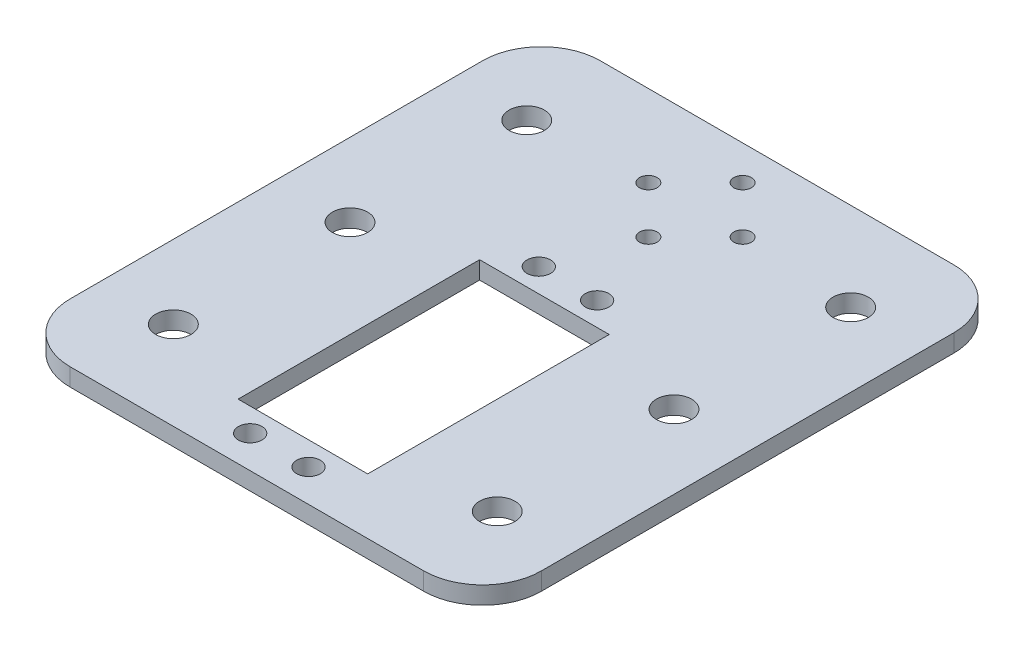
from build123d import *

# Parameters (mm, degrees)
SKETCH_1_W          = 80
SKETCH_1_H          = 90
SKETCH_1_R          = 3
SKETCH_1_R_2        = 2
SKETCH_1_W_2        = 22
SKETCH_1_H_2        = 41
EXTRUDE_1_DEPTH     = 3
FILLET_1_R          = 10
SKETCH_2_R          = 1.5
CUT_EXTRUDE_1_DEPTH = 73.173402303


with BuildPart() as part:
    # 草图1 → 凸台-拉伸1 (new body)
    with BuildSketch(Plane(origin=(0, 0, 0), x_dir=(1, 0, 0), z_dir=(0, 1, 0))):
        with Locations((0, 15)):
            Rectangle(SKETCH_1_W, SKETCH_1_H)
        with Locations(Location((27.5, 15, 0), (0, 0, 270))):
            Circle(SKETCH_1_R, mode=Mode.SUBTRACT)
        with Locations(Location((27.5, -15, 0), (0, 0, 270))):
            Circle(SKETCH_1_R, mode=Mode.SUBTRACT)
        with Locations(Location((-27.5, -15, 0), (0, 0, 90))):
            Circle(SKETCH_1_R, mode=Mode.SUBTRACT)
        with Locations(Location((-27.5, 15, 0), (0, 0, 90))):
            Circle(SKETCH_1_R, mode=Mode.SUBTRACT)
        with Locations(Location((4.95, 24.5, 0), (0, 0, 270))):
            Circle(SKETCH_1_R_2, mode=Mode.SUBTRACT)
        with Locations(Location((-4.95, 24.5, 0), (0, 0, 90))):
            Circle(SKETCH_1_R_2, mode=Mode.SUBTRACT)
        with Locations(Location((4.95, -24.5, 0), (0, 0, 90))):
            Circle(SKETCH_1_R_2, mode=Mode.SUBTRACT)
        with Locations(Location((-4.95, -24.5, 0), (0, 0, 270))):
            Circle(SKETCH_1_R_2, mode=Mode.SUBTRACT)
        with Locations(Location((-27.5, 45, 0), (0, 0, 90))):
            Circle(SKETCH_1_R, mode=Mode.SUBTRACT)
        with Locations(Location((27.5, 45, 0), (0, 0, 270))):
            Circle(SKETCH_1_R, mode=Mode.SUBTRACT)
        Rectangle(SKETCH_1_W_2, SKETCH_1_H_2, mode=Mode.SUBTRACT)
    extrude(amount=EXTRUDE_1_DEPTH)

    # 圆角1
    fillet_1_edges = [part.edges().sort_by_distance(p)[0] for p in [
        (40, 1.5, -60),
        (40, 1.5, 30),
        (-40, 1.5, 30),
        (-40, 1.5, -60),
    ]]
    fillet(fillet_1_edges, radius=FILLET_1_R)

    # 草图2 → 切除-拉伸1 (cut, through all)
    with BuildSketch(Plane(origin=(0, 0, 0), x_dir=(1, 0, 0), z_dir=(0, 1, 0))):
        with Locations(Location((0, 54.15, 0), (0, 0, 270))):
            Circle(SKETCH_2_R)
        with Locations(Location((8, 46.15, 0), (0, 0, 270))):
            Circle(SKETCH_2_R)
        with Locations(Location((0, 38.15, 0), (0, 0, 270))):
            Circle(SKETCH_2_R)
        with Locations(Location((-8, 46.15, 0), (0, 0, 270))):
            Circle(SKETCH_2_R)
    extrude(amount=CUT_EXTRUDE_1_DEPTH, mode=Mode.SUBTRACT)


solid = part.part
